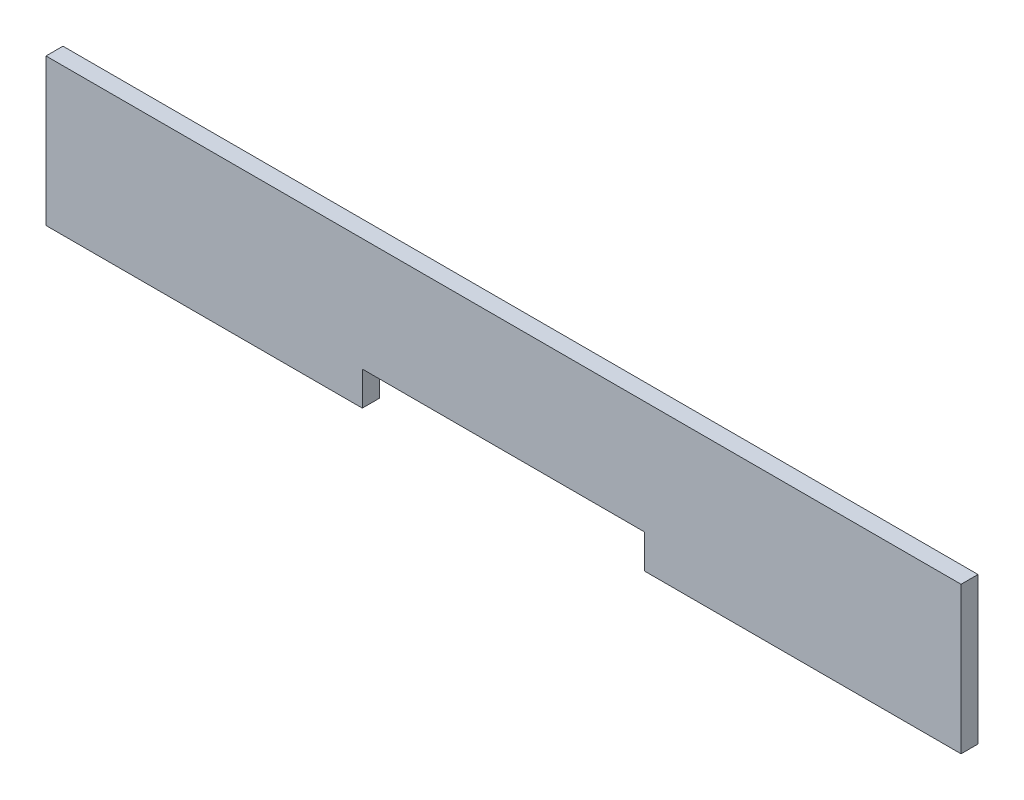
from build123d import *

# Parameters (mm, degrees)
BOSS_EXTRUDE1_DEPTH = 3


with BuildPart() as part:
    # Sketch1 → Boss-Extrude1 (new body)
    with BuildSketch(Plane.XY):
        Polygon((0, 0), (56, 0), (56, 6), (106, 6), (106, 0), (162, 0), (162, 26), (0, 26), align=None)
    extrude(amount=BOSS_EXTRUDE1_DEPTH)


solid = part.part
